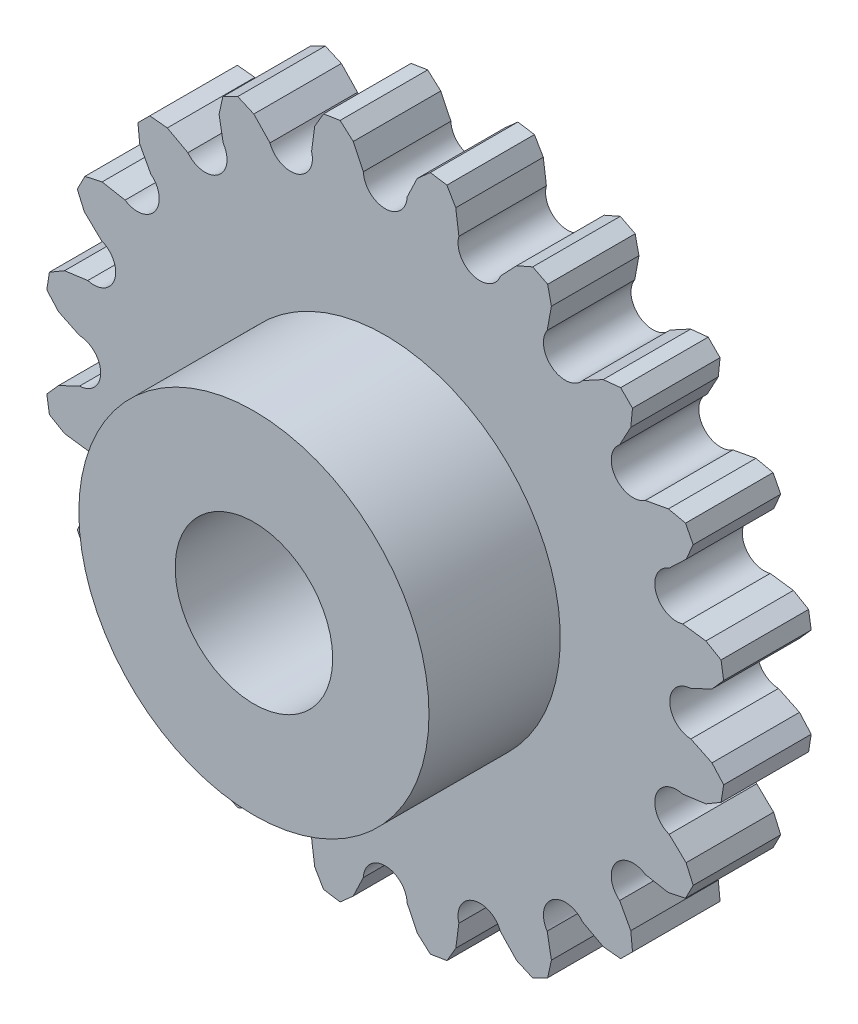
from build123d import *

# Parameters (mm, degrees)
SKETCH_4_R      = 9
EXTRUDE_3_DEPTH = 10
EXTRUDE_START   = 15
SKETCH_6_R      = 20
SKETCH_6_R_2    = 9
EXTRUDE_4_DEPTH = 15


with BuildPart() as part:
    # 草圖4 → 填料-伸長3 (new body)
    with BuildSketch(Plane.XY):
        with BuildLine():
            Line((2.498405104, 34.910714286), (3.655076706, 37.321447108))
            Line((3.655076706, 37.321447108), (5.153563847, 38.657997616))
            Line((5.153563847, 38.657997616), (7.044647753, 38.35847935))
            Line((7.044647753, 38.35847935), (8.056776892, 36.624286288))
            Line((8.056776892, 36.624286288), (8.411879546, 33.974111946))
            ThreePointArc((8.411879546, 33.974111946), (8.608704453, 32.11239943), (10.043052317, 30.90933678))
            ThreePointArc((10.043052317, 30.90933678), (11.910606599, 31.039546388), (13.164128454, 32.430012674))
            Line((13.164128454, 32.430012674), (15.00914593, 34.365324652))
            Line((15.00914593, 34.365324652), (16.84730871, 35.173401729))
            Line((16.84730871, 35.173401729), (18.553280148, 34.304165866))
            Line((18.553280148, 34.304165866), (18.979977034, 32.342085149))
            Line((18.979977034, 32.342085149), (18.498750817, 29.711886817))
            ThreePointArc((18.498750817, 29.711886817), (18.110641621, 27.880470756), (19.1030207, 26.293052317))
            ThreePointArc((19.1030207, 26.293052317), (20.91940735, 25.839783003), (22.541255192, 26.774835469))
            Line((22.541255192, 26.774835469), (24.894015376, 28.045284782))
            Line((24.894015376, 28.045284782), (26.891921615, 28.245788214))
            Line((26.891921615, 28.245788214), (28.245788214, 26.891921615))
            Line((28.245788214, 26.891921615), (28.045284782, 24.894015376))
            Line((28.045284782, 24.894015376), (26.774835469, 22.541255192))
            ThreePointArc((26.774835469, 22.541255192), (25.839783003, 20.91940735), (26.293052317, 19.1030207))
            ThreePointArc((26.293052317, 19.1030207), (27.880470756, 18.110641621), (29.711886817, 18.498750817))
            Line((29.711886817, 18.498750817), (32.342085149, 18.979977034))
            Line((32.342085149, 18.979977034), (34.304165866, 18.553280148))
            Line((34.304165866, 18.553280148), (35.173401729, 16.84730871))
            Line((35.173401729, 16.84730871), (34.365324652, 15.00914593))
            Line((34.365324652, 15.00914593), (32.430012674, 13.164128454))
            ThreePointArc((32.430012674, 13.164128454), (31.039546388, 11.910606599), (30.90933678, 10.043052317))
            ThreePointArc((30.90933678, 10.043052317), (32.11239943, 8.608704453), (33.974111946, 8.411879546))
            Line((33.974111946, 8.411879546), (36.624286288, 8.056776892))
            Line((36.624286288, 8.056776892), (38.35847935, 7.044647753))
            Line((38.35847935, 7.044647753), (38.657997616, 5.153563847))
            Line((38.657997616, 5.153563847), (37.321447108, 3.655076706))
            Line((37.321447108, 3.655076706), (34.910714286, 2.498405104))
            ThreePointArc((34.910714286, 2.498405104), (33.200942707, 1.735912687), (32.5, 0))
            ThreePointArc((32.5, 0), (33.200942707, -1.735912687), (34.910714286, -2.498405104))
            Line((34.910714286, -2.498405104), (37.321447108, -3.655076706))
            Line((37.321447108, -3.655076706), (38.657997616, -5.153563847))
            Line((38.657997616, -5.153563847), (38.35847935, -7.044647753))
            Line((38.35847935, -7.044647753), (36.624286288, -8.056776892))
            Line((36.624286288, -8.056776892), (33.974111946, -8.411879546))
            ThreePointArc((33.974111946, -8.411879546), (32.11239943, -8.608704453), (30.90933678, -10.043052317))
            ThreePointArc((30.90933678, -10.043052317), (31.039546388, -11.910606599), (32.430012674, -13.164128454))
            Line((32.430012674, -13.164128454), (34.365324652, -15.00914593))
            Line((34.365324652, -15.00914593), (35.173401729, -16.84730871))
            Line((35.173401729, -16.84730871), (34.304165866, -18.553280148))
            Line((34.304165866, -18.553280148), (32.342085149, -18.979977034))
            Line((32.342085149, -18.979977034), (29.711886817, -18.498750817))
            ThreePointArc((29.711886817, -18.498750817), (27.880470756, -18.110641621), (26.293052317, -19.1030207))
            ThreePointArc((26.293052317, -19.1030207), (25.839783003, -20.91940735), (26.774835469, -22.541255192))
            Line((26.774835469, -22.541255192), (28.045284782, -24.894015376))
            Line((28.045284782, -24.894015376), (28.245788214, -26.891921615))
            Line((28.245788214, -26.891921615), (26.891921615, -28.245788214))
            Line((26.891921615, -28.245788214), (24.894015376, -28.045284782))
            Line((24.894015376, -28.045284782), (22.541255192, -26.774835469))
            ThreePointArc((22.541255192, -26.774835469), (20.91940735, -25.839783003), (19.1030207, -26.293052317))
            ThreePointArc((19.1030207, -26.293052317), (18.110641621, -27.880470756), (18.498750817, -29.711886817))
            Line((18.498750817, -29.711886817), (18.979977034, -32.342085149))
            Line((18.979977034, -32.342085149), (18.553280148, -34.304165866))
            Line((18.553280148, -34.304165866), (16.84730871, -35.173401729))
            Line((16.84730871, -35.173401729), (15.00914593, -34.365324652))
            Line((15.00914593, -34.365324652), (13.164128454, -32.430012674))
            ThreePointArc((13.164128454, -32.430012674), (11.910606599, -31.039546388), (10.043052317, -30.90933678))
            ThreePointArc((10.043052317, -30.90933678), (8.608704453, -32.11239943), (8.411879546, -33.974111946))
            Line((8.411879546, -33.974111946), (8.056776892, -36.624286288))
            Line((8.056776892, -36.624286288), (7.044647753, -38.35847935))
            Line((7.044647753, -38.35847935), (5.153563847, -38.657997616))
            Line((5.153563847, -38.657997616), (3.655076706, -37.321447108))
            Line((3.655076706, -37.321447108), (2.498405104, -34.910714286))
            ThreePointArc((2.498405104, -34.910714286), (1.735912687, -33.200942707), (0, -32.5))
            ThreePointArc((0, -32.5), (-1.735912687, -33.200942707), (-2.498405104, -34.910714286))
            Line((-2.498405104, -34.910714286), (-3.655076706, -37.321447108))
            Line((-3.655076706, -37.321447108), (-5.153563847, -38.657997616))
            Line((-5.153563847, -38.657997616), (-7.044647753, -38.35847935))
            Line((-7.044647753, -38.35847935), (-8.056776892, -36.624286288))
            Line((-8.056776892, -36.624286288), (-8.411879546, -33.974111946))
            ThreePointArc((-8.411879546, -33.974111946), (-8.608704453, -32.11239943), (-10.043052317, -30.90933678))
            ThreePointArc((-10.043052317, -30.90933678), (-11.910606599, -31.039546388), (-13.164128454, -32.430012674))
            Line((-13.164128454, -32.430012674), (-15.00914593, -34.365324652))
            Line((-15.00914593, -34.365324652), (-16.84730871, -35.173401729))
            Line((-16.84730871, -35.173401729), (-18.553280148, -34.304165866))
            Line((-18.553280148, -34.304165866), (-18.979977034, -32.342085149))
            Line((-18.979977034, -32.342085149), (-18.498750817, -29.711886817))
            ThreePointArc((-18.498750817, -29.711886817), (-18.110641621, -27.880470756), (-19.1030207, -26.293052317))
            ThreePointArc((-19.1030207, -26.293052317), (-20.91940735, -25.839783003), (-22.541255192, -26.774835469))
            Line((-22.541255192, -26.774835469), (-24.894015376, -28.045284782))
            Line((-24.894015376, -28.045284782), (-26.891921615, -28.245788214))
            Line((-26.891921615, -28.245788214), (-28.245788214, -26.891921615))
            Line((-28.245788214, -26.891921615), (-28.045284782, -24.894015376))
            Line((-28.045284782, -24.894015376), (-26.774835469, -22.541255192))
            ThreePointArc((-26.774835469, -22.541255192), (-25.839783003, -20.91940735), (-26.293052317, -19.1030207))
            ThreePointArc((-26.293052317, -19.1030207), (-27.880470756, -18.110641621), (-29.711886817, -18.498750817))
            Line((-29.711886817, -18.498750817), (-32.342085149, -18.979977034))
            Line((-32.342085149, -18.979977034), (-34.304165866, -18.553280148))
            Line((-34.304165866, -18.553280148), (-35.173401729, -16.84730871))
            Line((-35.173401729, -16.84730871), (-34.365324652, -15.00914593))
            Line((-34.365324652, -15.00914593), (-32.430012674, -13.164128454))
            ThreePointArc((-32.430012674, -13.164128454), (-31.039546388, -11.910606599), (-30.90933678, -10.043052317))
            ThreePointArc((-30.90933678, -10.043052317), (-32.11239943, -8.608704453), (-33.974111946, -8.411879546))
            Line((-33.974111946, -8.411879546), (-36.624286288, -8.056776892))
            Line((-36.624286288, -8.056776892), (-38.35847935, -7.044647753))
            Line((-38.35847935, -7.044647753), (-38.657997616, -5.153563847))
            Line((-38.657997616, -5.153563847), (-37.321447108, -3.655076706))
            Line((-37.321447108, -3.655076706), (-34.910714286, -2.498405104))
            ThreePointArc((-34.910714286, -2.498405104), (-33.200942707, -1.735912687), (-32.5, 0))
            ThreePointArc((-32.5, 0), (-33.200942707, 1.735912687), (-34.910714286, 2.498405104))
            Line((-34.910714286, 2.498405104), (-37.321447108, 3.655076706))
            Line((-37.321447108, 3.655076706), (-38.657997616, 5.153563847))
            Line((-38.657997616, 5.153563847), (-38.35847935, 7.044647753))
            Line((-38.35847935, 7.044647753), (-36.624286288, 8.056776892))
            Line((-36.624286288, 8.056776892), (-33.974111946, 8.411879546))
            ThreePointArc((-33.974111946, 8.411879546), (-32.11239943, 8.608704453), (-30.90933678, 10.043052317))
            ThreePointArc((-30.90933678, 10.043052317), (-31.039546388, 11.910606599), (-32.430012674, 13.164128454))
            Line((-32.430012674, 13.164128454), (-34.365324652, 15.00914593))
            Line((-34.365324652, 15.00914593), (-35.173401729, 16.84730871))
            Line((-35.173401729, 16.84730871), (-34.304165866, 18.553280148))
            Line((-34.304165866, 18.553280148), (-32.342085149, 18.979977034))
            Line((-32.342085149, 18.979977034), (-29.711886817, 18.498750817))
            ThreePointArc((-29.711886817, 18.498750817), (-27.880470756, 18.110641621), (-26.293052317, 19.1030207))
            ThreePointArc((-26.293052317, 19.1030207), (-25.839783003, 20.91940735), (-26.774835469, 22.541255192))
            Line((-26.774835469, 22.541255192), (-28.045284782, 24.894015376))
            Line((-28.045284782, 24.894015376), (-28.245788214, 26.891921615))
            Line((-28.245788214, 26.891921615), (-26.891921615, 28.245788214))
            Line((-26.891921615, 28.245788214), (-24.894015376, 28.045284782))
            Line((-24.894015376, 28.045284782), (-22.541255192, 26.774835469))
            ThreePointArc((-22.541255192, 26.774835469), (-20.91940735, 25.839783003), (-19.1030207, 26.293052317))
            ThreePointArc((-19.1030207, 26.293052317), (-18.110641621, 27.880470756), (-18.498750817, 29.711886817))
            Line((-18.498750817, 29.711886817), (-18.979977034, 32.342085149))
            Line((-18.979977034, 32.342085149), (-18.553280148, 34.304165866))
            Line((-18.553280148, 34.304165866), (-16.84730871, 35.173401729))
            Line((-16.84730871, 35.173401729), (-15.00914593, 34.365324652))
            Line((-15.00914593, 34.365324652), (-13.164128454, 32.430012674))
            ThreePointArc((-13.164128454, 32.430012674), (-11.910606599, 31.039546388), (-10.043052317, 30.90933678))
            ThreePointArc((-10.043052317, 30.90933678), (-8.608704453, 32.11239943), (-8.411879546, 33.974111946))
            Line((-8.411879546, 33.974111946), (-8.056776892, 36.624286288))
            Line((-8.056776892, 36.624286288), (-7.044647753, 38.35847935))
            Line((-7.044647753, 38.35847935), (-5.153563847, 38.657997616))
            Line((-5.153563847, 38.657997616), (-3.655076706, 37.321447108))
            Line((-3.655076706, 37.321447108), (-2.498405104, 34.910714286))
            ThreePointArc((-2.498405104, 34.910714286), (-1.735912687, 33.200942707), (0, 32.5))
            ThreePointArc((0, 32.5), (1.735912687, 33.200942707), (2.498405104, 34.910714286))
        make_face()
        Circle(SKETCH_4_R, mode=Mode.SUBTRACT)
    extrude(amount=-EXTRUDE_3_DEPTH)

    # 草圖6 → 填料-伸長4 (add)
    with BuildSketch(Plane.XY.offset(EXTRUDE_START)):
        with Locations(Location((0, 0, 0), (0, 0, 180))):
            Circle(SKETCH_6_R)
        Circle(SKETCH_6_R_2, mode=Mode.SUBTRACT)
    extrude(amount=-EXTRUDE_4_DEPTH)


solid = part.part
